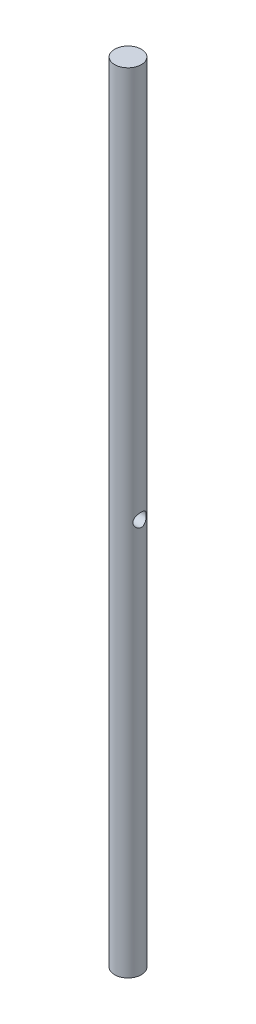
from build123d import *

# Parameters (mm, degrees)
SKETCH1_R               = 1
BOSS_EXTRUDE1_DEPTH     = 59
CUT_EXTRUDE1_DEPTH      = 60.016946719
CUT_EXTRUDE1_DEPTH_BACK = 60.016946719
SKETCH2_R               = 0.5


with BuildPart() as part:
    # Sketch1 → Boss-Extrude1 (new body)
    with BuildSketch(Plane(origin=(0, 0, 0), x_dir=(1, 0, 0), z_dir=(0, 1, 0))):
        with Locations(Location((0, 0, 0), (0, 0, 270))):
            Circle(SKETCH1_R)
    extrude(amount=BOSS_EXTRUDE1_DEPTH)

    # Sketch2 → Cut-Extrude1 (cut, two sides: drawn at the far end of the back side and taken through both)
    with BuildSketch(Plane(origin=(0, 0, 0), x_dir=(0, 0, -1), z_dir=(1, 0, 0)).offset(-CUT_EXTRUDE1_DEPTH_BACK)):
        with Locations((0, 29.5)):
            Circle(SKETCH2_R)
    extrude(amount=CUT_EXTRUDE1_DEPTH + CUT_EXTRUDE1_DEPTH_BACK, mode=Mode.SUBTRACT)


solid = part.part
